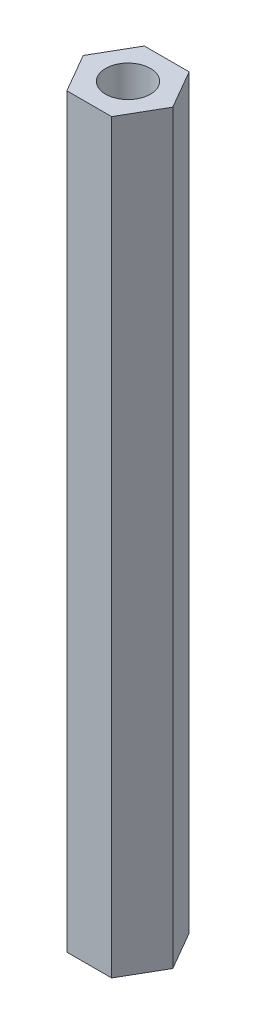
from build123d import *

# Parameters (mm, degrees)
SKETCH1_R           = 1.5
BOSS_EXTRUDE1_DEPTH = 50


with BuildPart() as part:
    # Sketch1 → Boss-Extrude1 (new body)
    with BuildSketch(Plane(origin=(0, 0, 0), x_dir=(1, 0, 0), z_dir=(0, 1, 0))):
        Polygon((1.5, 2.598076211), (-1.5, 2.598076211), (-3, 0), (-1.5, -2.598076211), (1.5, -2.598076211), (3, 0), align=None)
        with Locations(Location((0, 0, 0), (0, 0, 270))):
            Circle(SKETCH1_R, mode=Mode.SUBTRACT)
    extrude(amount=BOSS_EXTRUDE1_DEPTH)


solid = part.part
